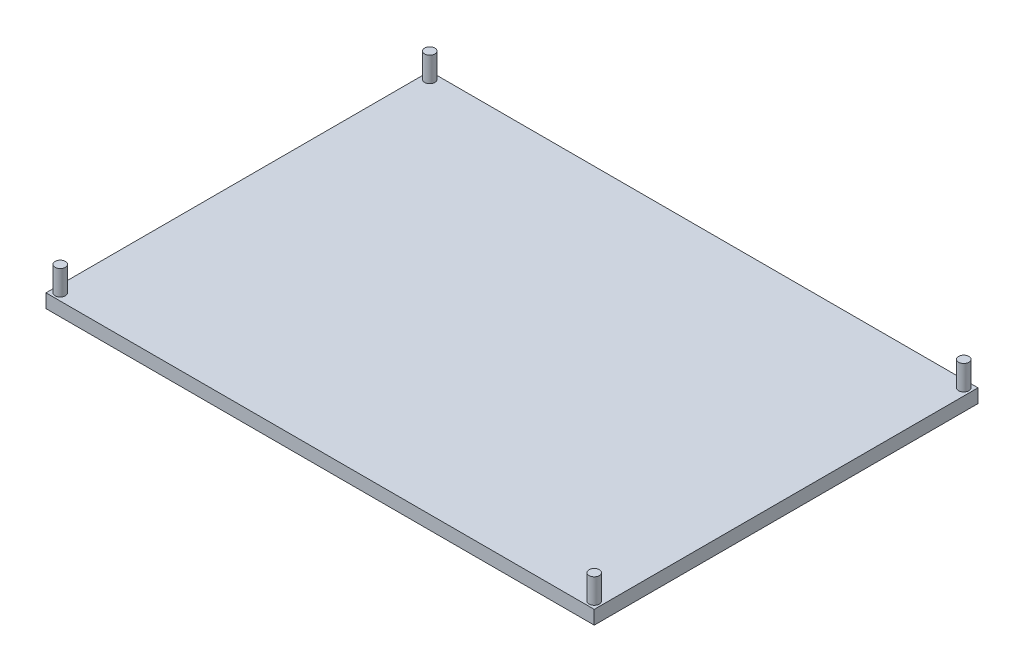
from build123d import *

# Parameters (mm, degrees)
SKETCH1_W           = 254
SKETCH1_H           = 177.8
BOSS_EXTRUDE1_DEPTH = 6.35
SKETCH2_R           = 2.38125
BOSS_EXTRUDE2_DEPTH = 11.43


with BuildPart() as part:
    # Sketch1 → Boss-Extrude1 (new body)
    with BuildSketch(Plane(origin=(0, 0, 0), x_dir=(1, 0, 0), z_dir=(0, 1, 0))):
        Rectangle(SKETCH1_W, SKETCH1_H)
    extrude(amount=BOSS_EXTRUDE1_DEPTH)

    # Sketch2 → Boss-Extrude2 (add)
    with BuildSketch(Plane(origin=(0, 6.35, 0), x_dir=(1, 0, 0), z_dir=(0, 1, 0))):
        with Locations(Location((-123.698, -85.598, 0), (0, 0, 90))):
            Circle(SKETCH2_R)
        with Locations(Location((-123.698, 85.598, 0), (0, 0, 90))):
            Circle(SKETCH2_R)
        with Locations(Location((123.698, 85.598, 0), (0, 0, 90))):
            Circle(SKETCH2_R)
        with Locations(Location((123.698, -85.598, 0), (0, 0, 90))):
            Circle(SKETCH2_R)
    extrude(amount=BOSS_EXTRUDE2_DEPTH)


solid = part.part
